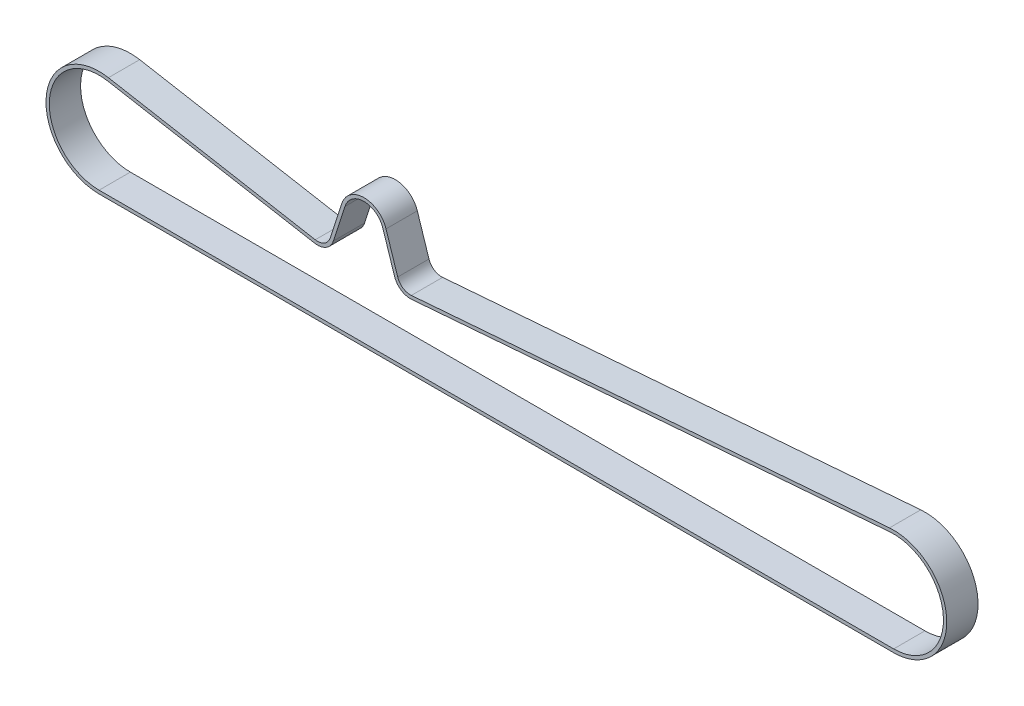
from build123d import *

# Parameters (mm, degrees)
BOSS_EXTRUDE1_DEPTH = 7.5


with BuildPart() as part:
    # Sketch1 → Boss-Extrude1 (new, symmetric)
    with BuildSketch(Plane.XY):
        with BuildLine():
            Line((103.658753776, 7.356207616), (4.476147359, 25.066988991))
            ThreePointArc((4.476147359, 25.066988991), (-25.364178544, 2.246837564), (0, -25.4635))
            Line((0, -25.4635), (381, -25.4635))
            ThreePointArc((381, -25.4635), (406.443730831, 1.003191728), (378.995174246, 25.384454021))
            Line((378.995174246, 25.384454021), (149.724956547, 7.277039279))
            ThreePointArc((149.724956547, 7.277039279), (145.698613571, 8.326503384), (143.18635498, 11.643334619))
            Line((143.18635498, 11.643334619), (137.591783364, 28.84484275))
            ThreePointArc((137.591783364, 28.84484275), (127, 36.5379), (116.408216636, 28.84484275))
            Line((116.408216636, 28.84484275), (110.81364502, 11.643334619))
            ThreePointArc((110.81364502, 11.643334619), (108.038796403, 8.16029732), (103.658753776, 7.356207616))
        make_face()
        with BuildLine():
            Line((0, -23.876), (381, -23.876))
            ThreePointArc((381, -23.876), (404.857463323, 0.940648602), (379.120163383, 23.801882075))
            Line((379.120163383, 23.801882075), (149.849945684, 5.694467333))
            ThreePointArc((149.849945684, 5.694467333), (144.817016963, 7.006297463), (141.676693726, 11.152336508))
            Line((141.676693726, 11.152336508), (136.082122109, 28.353844639))
            ThreePointArc((136.082122109, 28.353844639), (127, 34.9504), (117.917877891, 28.353844639))
            Line((117.917877891, 28.353844639), (112.323306274, 11.152336508))
            ThreePointArc((112.323306274, 11.152336508), (108.854745504, 6.798539884), (103.37969222, 5.793427754))
            Line((103.37969222, 5.793427754), (4.197085803, 23.504209129))
            ThreePointArc((4.197085803, 23.504209129), (-23.782870655, 2.106760409), (0, -23.876))
        make_face(mode=Mode.SUBTRACT)
    extrude(amount=BOSS_EXTRUDE1_DEPTH, both=True)


solid = part.part
